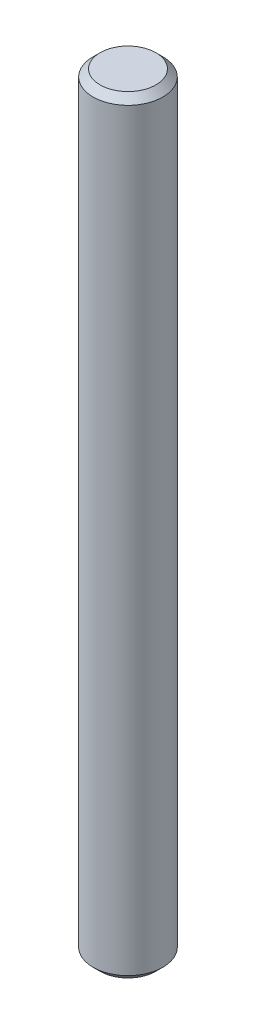
from build123d import *

# Parameters (mm, degrees)
IZIM1_R                          = 0.5
Y_KSEKLIK_EKSTR_ZYON1_DEPTH      = 5
PAH1_SIZE                        = 0.1
Y_KSEKLIK_EKSTR_ZYON2_DEPTH      = 1
Y_KSEKLIK_EKSTR_ZYON2_DEPTH_BACK = 1
IZIM2_R                          = 0.5
PAH2_SIZE                        = 0.1


with BuildPart() as part:
    # Çizim1 → Yükseklik-Ekstrüzyon1 (new, symmetric)
    with BuildSketch(Plane(origin=(0, 0, 0), x_dir=(1, 0, 0), z_dir=(0, 1, 0))):
        with Locations(Location((0, 0, 0), (0, 0, 270))):
            Circle(IZIM1_R)
    extrude(amount=Y_KSEKLIK_EKSTR_ZYON1_DEPTH, both=True)

    # Pah1
    pah1_edges = [part.edges().sort_by_distance(p)[0] for p in [
        (0, -5, -0.5),
        (0, 5, -0.5),
    ]]
    chamfer(pah1_edges, length=PAH1_SIZE)

    # Çizim2 → Yükseklik-Ekstrüzyon2 (add, two sides: drawn at the far end of the back side and taken through both)
    with BuildSketch(Plane(origin=(0, 5, 0), x_dir=(1, 0, 0), z_dir=(0, 1, 0)).offset(-Y_KSEKLIK_EKSTR_ZYON2_DEPTH_BACK)):
        with Locations(Location((0, 0, 0), (0, 0, 270))):
            Circle(IZIM2_R)
    extrude(amount=Y_KSEKLIK_EKSTR_ZYON2_DEPTH + Y_KSEKLIK_EKSTR_ZYON2_DEPTH_BACK)

    # Pah2
    pah2_edges = [part.edges().sort_by_distance(p)[0] for p in [
        (0, 6, -0.5),
    ]]
    chamfer(pah2_edges, length=PAH2_SIZE)


solid = part.part
